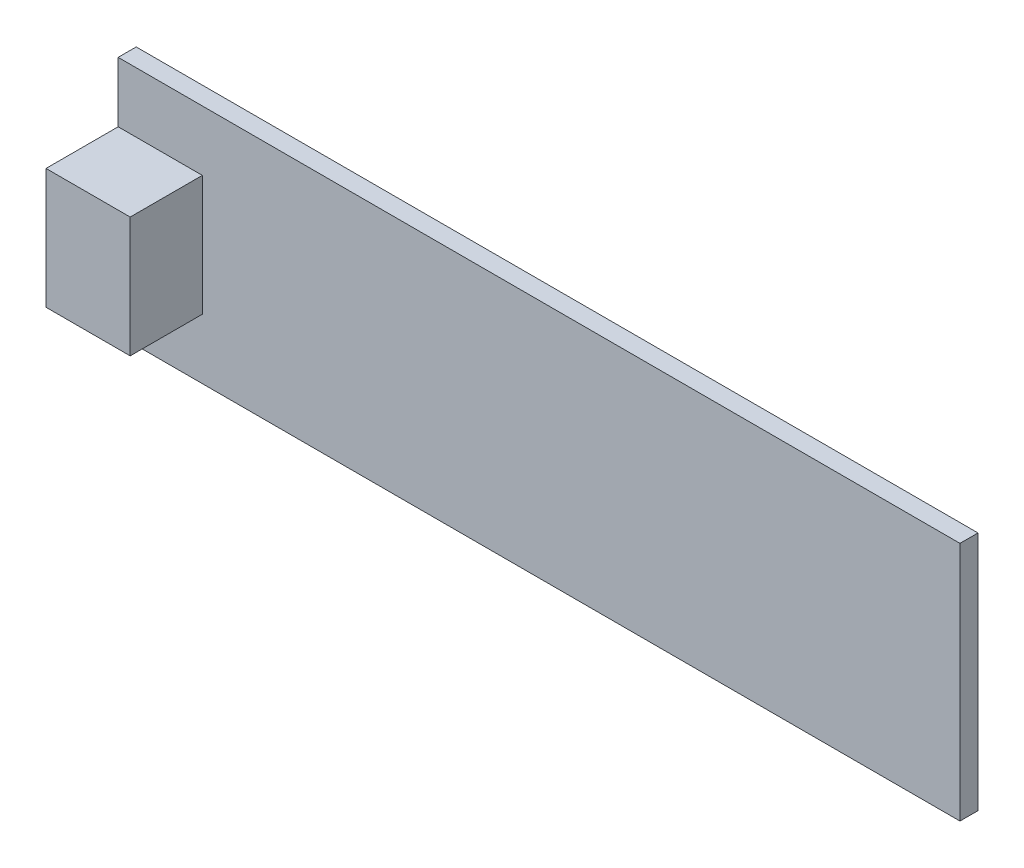
from build123d import *

# Parameters (mm, degrees)
SKETCH1_W           = 70
SKETCH1_H           = 20
BOSS_EXTRUDE1_DEPTH = 0.75
SKETCH2_W           = 7
SKETCH2_H           = 10
BOSS_EXTRUDE2_DEPTH = 6


with BuildPart() as part:
    # Sketch1 → Boss-Extrude1 (new, symmetric)
    with BuildSketch(Plane.XY):
        Rectangle(SKETCH1_W, SKETCH1_H)
    extrude(amount=BOSS_EXTRUDE1_DEPTH, both=True)

    # Sketch2 → Boss-Extrude2 (add)
    with BuildSketch(Plane.XY.offset(0.75)):
        with Locations((-31.5, 0)):
            Rectangle(SKETCH2_W, SKETCH2_H)
    extrude(amount=BOSS_EXTRUDE2_DEPTH)


solid = part.part
